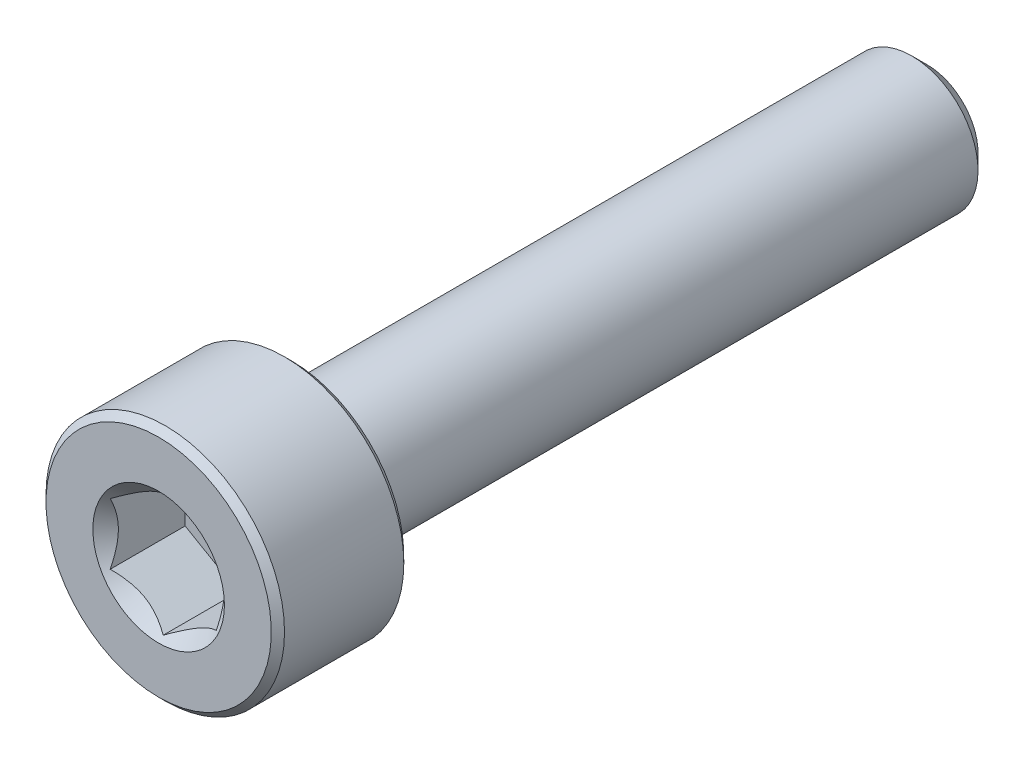
from build123d import *

# Parameters (mm, degrees)
CUT_EXTRUDE1_DEPTH     = 1.5
SPLIT1_SURFACE_1_BACK  = 16.835
SPLIT1_SURFACE_1_DEPTH = 33.67
SPLIT1_SURFACE_2_BACK  = 16.835
SPLIT1_SURFACE_2_DEPTH = 33.67


with BuildPart() as part:
    # Sketch2 → Revolve1 (revolve)
    with BuildSketch(Plane(origin=(0, 0, 0), x_dir=(0, 0, -1), z_dir=(1, 0, 0))):
        with BuildLine():
            Line((-7.25, 0), (-7.25, 2.125))
            Line((-7.25, 2.125), (-7.125, 2.25))
            Line((-7.125, 2.25), (-4.875, 2.25))
            Line((-4.875, 2.25), (-4.75, 2.125))
            Line((-4.75, 2.125), (-4.75, 1.375))
            ThreePointArc((-4.75, 1.375), (-4.713388348, 1.286611652), (-4.625, 1.25))
            Line((-4.625, 1.25), (6.957716426, 1.25))
            Line((6.957716426, 1.25), (7.25, 0.957716426))
            Line((7.25, 0.957716426), (7.25, 0))
            Line((7.25, 0), (-7.25, 0))
        make_face()
    revolve(axis=Axis((0, 0, -7.25), (0, 0, 1)))

    # Sketch3 → Cut-Extrude1 (cut)
    with BuildSketch(Plane.XY.offset(7.25)):
        Polygon((1, -0.577350269), (1, 0.577350269), (0, 1.154700538), (-1, 0.577350269), (-1, -0.577350269), (0, -1.154700538), align=None)
    extrude(amount=-CUT_EXTRUDE1_DEPTH, mode=Mode.SUBTRACT)

    # Cut-Extrude2 cone 1 section (through the dimple's axis) → Cut-Extrude2 (revolve, cut)
    with BuildSketch(Plane(origin=(0, 0, 7.25), x_dir=(0, -1, 0), z_dir=(1, 0, 0))):
        Polygon((0, 0), (1.241303079, 0), (0, 1.241303079), align=None)
    revolve(axis=Axis((0, 0, 7.25), (0, 0, -1)), mode=Mode.SUBTRACT)


with BuildPart() as body_2:
    # Split1: the piece behind the surface
    add(part.part)
    # Split1 surface: a surface, the sketch's curves swept straight by 33.67 mm
    with BuildLine(Plane(origin=(0, 0, 0), x_dir=(0, 0, -1), z_dir=(1, 0, 0)).offset(-SPLIT1_SURFACE_1_BACK), mode=Mode.PRIVATE) as split1_surface_1_path:
        Line((-4.625, -2.25), (-4.625, 2.25))
    split1_surface_1 = Shell.extrude(split1_surface_1_path.wire(), (1 * SPLIT1_SURFACE_1_DEPTH, 0 * SPLIT1_SURFACE_1_DEPTH, 0 * SPLIT1_SURFACE_1_DEPTH))
    split(bisect_by=split1_surface_1, keep=Keep.BOTTOM)


with BuildPart() as part_1:
    add(part.part)

    # Split1: split by a surface, the side it looks to stays
    # Split1 surface: a surface, the sketch's curves swept straight by 33.67 mm
    with BuildLine(Plane(origin=(0, 0, 0), x_dir=(0, 0, -1), z_dir=(1, 0, 0)).offset(-SPLIT1_SURFACE_2_BACK), mode=Mode.PRIVATE) as split1_surface_2_path:
        Line((-4.625, -2.25), (-4.625, 2.25))
    split1_surface_2 = Shell.extrude(split1_surface_2_path.wire(), (1 * SPLIT1_SURFACE_2_DEPTH, 0 * SPLIT1_SURFACE_2_DEPTH, 0 * SPLIT1_SURFACE_2_DEPTH))
    split(bisect_by=split1_surface_2, keep=Keep.TOP)

    # Sketch8 → Revolve2 (revolve)
    with BuildSketch(Plane(origin=(0, 0, 0), x_dir=(0, 0, -1), z_dir=(1, 0, 0)), mode=Mode.PRIVATE) as revolve2_sk:
        Polygon((-4.75, 0), (-4.75, 1.25), (-4.625, 1.25), (-3.903312164, 0), align=None)
    revolve(revolve2_sk.sketch.rotate(Axis((0, 0, 3.903312164), (0, 0, 1)), 270), axis=Axis((0, 0, 3.903312164), (0, 0, 1)))


solid = Compound([body_2.part, part_1.part])
